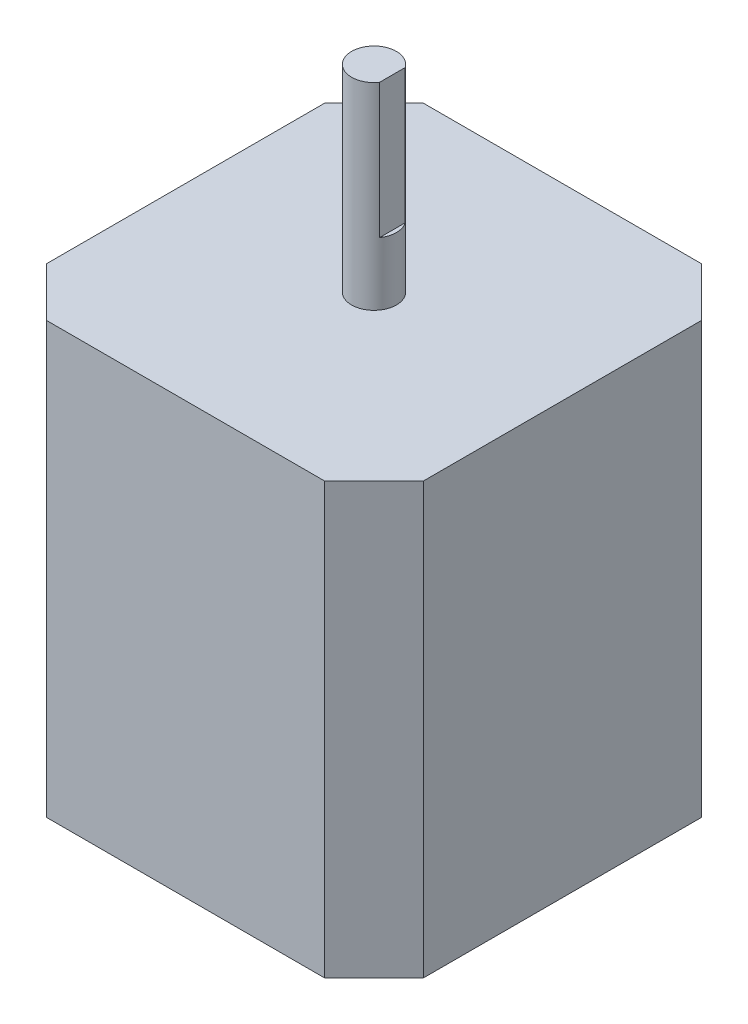
from build123d import *

# Parameters (mm, degrees)
SKETCH1_W           = 42
SKETCH1_H           = 42
BODY_DEPTH          = 48
CHAMFER1_SIZE       = 5.5
SKETCH2_R           = 2.5
SHAFT_DEPTH         = 22
SHAFTORIENTER_START = -15
SHAFTORIENTER_DEPTH = 15


with BuildPart() as part:
    # Sketch1 → Body (new body)
    with BuildSketch(Plane(origin=(0, 0, 0), x_dir=(1, 0, 0), z_dir=(0, 1, 0))):
        with Locations((21, 21)):
            Rectangle(SKETCH1_W, SKETCH1_H)
    extrude(amount=BODY_DEPTH)

    # Chamfer1
    chamfer1_edges = [part.edges().sort_by_distance(p)[0] for p in [
        (0, 24, -42),
        (42, 24, -42),
        (42, 24, 0),
        (0, 24, 0),
    ]]
    chamfer(chamfer1_edges, length=CHAMFER1_SIZE)

    # Sketch2 → Shaft (add)
    with BuildSketch(Plane(origin=(0, 48, 0), x_dir=(1, 0, 0), z_dir=(0, 1, 0))):
        with Locations(Location((21, 21, 0), (0, 0, 90))):
            Circle(SKETCH2_R)
    extrude(amount=SHAFT_DEPTH)

    # Sketch3 → ShaftOrienter (cut)
    with BuildSketch(Plane(origin=(0, 70, 0), x_dir=(1, 0, 0), z_dir=(0, 1, 0)).offset(SHAFTORIENTER_START)):
        with BuildLine():
            Line((23.05, 22.430908802), (23.05, 19.569091198))
            ThreePointArc((23.05, 19.569091198), (23.384848004, 20.25), (23.5, 21))
            ThreePointArc((23.5, 21), (23.384848004, 21.75), (23.05, 22.430908802))
        make_face()
    extrude(amount=SHAFTORIENTER_DEPTH, mode=Mode.SUBTRACT)


solid = part.part
